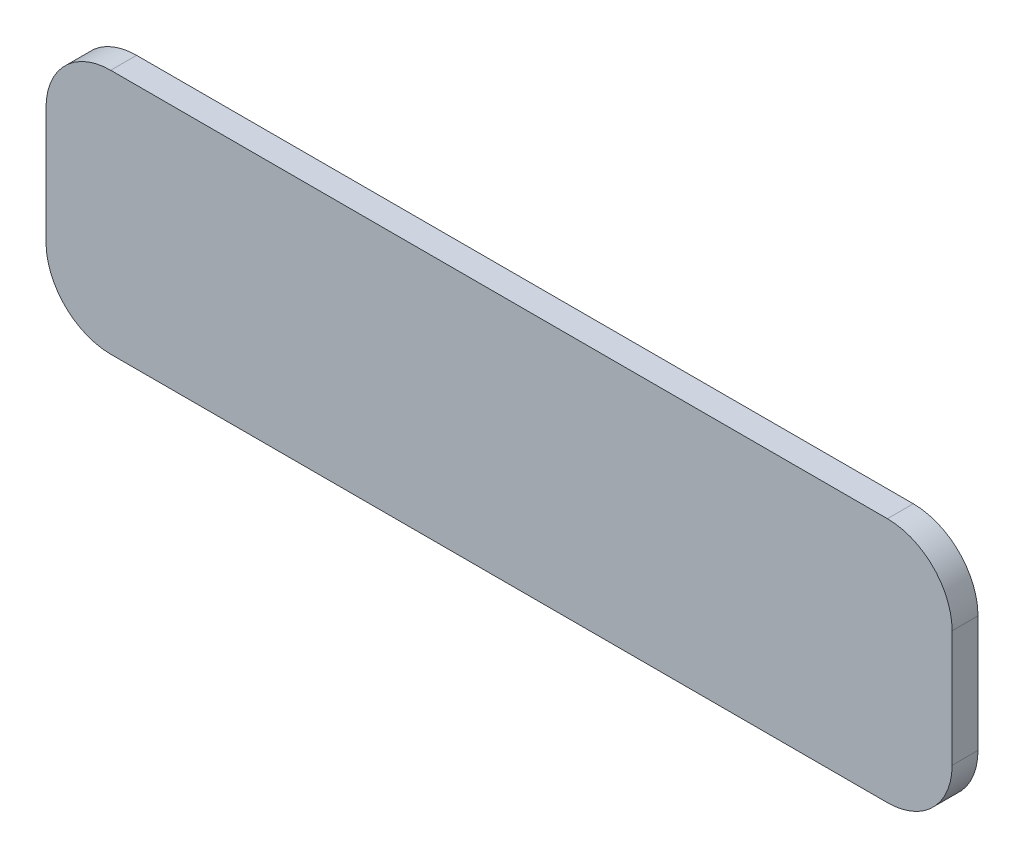
from build123d import *

# Parameters (mm, degrees)
EXTRUDE_1_DEPTH = 2


with BuildPart() as part:
    # 草图1 → 凸台-拉伸1 (new body)
    with BuildSketch(Plane.XY):
        with BuildLine():
            Line((5, 0), (65, 0))
            ThreePointArc((65, 0), (68.535533906, 1.464466094), (70, 5))
            Line((70, 5), (70, 14))
            ThreePointArc((70, 14), (68.535533906, 17.535533906), (65, 19))
            Line((65, 19), (5, 19))
            ThreePointArc((5, 19), (1.464466094, 17.535533906), (0, 14))
            Line((0, 14), (0, 5))
            ThreePointArc((0, 5), (1.464466094, 1.464466094), (5, 0))
        make_face()
    extrude(amount=EXTRUDE_1_DEPTH)


solid = part.part
